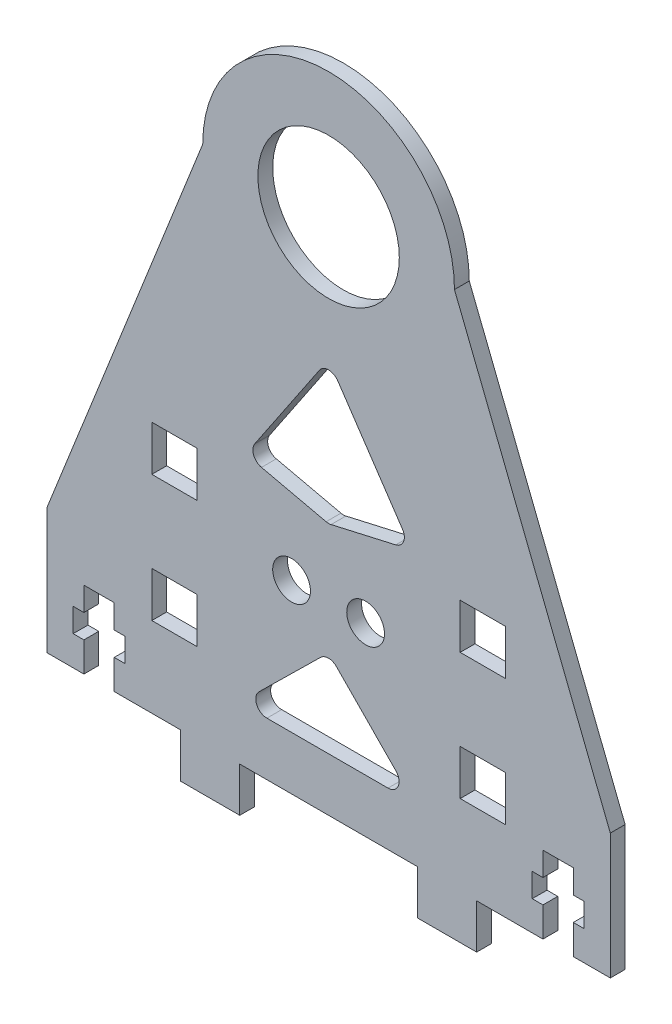
from build123d import *

# Parameters (mm, degrees)
SKETCH_1_R      = 9.55
SKETCH_1_R_2    = 2.55
SKETCH_1_W      = 6.1
SKETCH_1_H      = 6.1
EXTRUDE_1_DEPTH = 2
FILLET_3_R      = 1.5


with BuildPart() as part:
    # 草图1 → 凸台-拉伸1 (new body)
    with BuildSketch(Plane.XY):
        with BuildLine():
            Line((-28.741188564, 3.13029316), (-28.741188564, 7.13029316))
            Line((-28.741188564, 7.13029316), (-27.291188564, 7.13029316))
            Line((-27.291188564, 7.13029316), (-27.291188564, 10.33029316))
            Line((-27.291188564, 10.33029316), (-28.741188564, 10.33029316))
            Line((-28.741188564, 10.33029316), (-28.741188564, 13.53029316))
            Line((-28.741188564, 13.53029316), (-32.841188564, 13.53029316))
            Line((-32.841188564, 13.53029316), (-32.841188564, 10.33029316))
            Line((-32.841188564, 10.33029316), (-34.291188564, 10.33029316))
            Line((-34.291188564, 10.33029316), (-34.291188564, 7.13029316))
            Line((-34.291188564, 7.13029316), (-32.841188564, 7.13029316))
            Line((-32.841188564, 7.13029316), (-32.841188564, 3.13029316))
            Line((-32.841188564, 3.13029316), (-37.841188564, 3.13029316))
            Line((-37.841188564, 3.13029316), (-37.841188564, 20.08029316))
            Line((-37.841188564, 20.08029316), (-16.791188564, 73.13029316))
            ThreePointArc((-16.791188564, 73.13029316), (0.208811436, 90.13029316), (17.208811436, 73.13029316))
            Line((17.208811436, 73.13029316), (38.258811436, 20.08029316))
            Line((38.258811436, 20.08029316), (38.258811436, 3.13029316))
            Line((38.258811436, 3.13029316), (33.258811436, 3.13029316))
            Line((33.258811436, 3.13029316), (33.258811436, 7.13029316))
            Line((33.258811436, 7.13029316), (34.708811436, 7.13029316))
            Line((34.708811436, 7.13029316), (34.708811436, 10.33029316))
            Line((34.708811436, 10.33029316), (33.258811436, 10.33029316))
            Line((33.258811436, 10.33029316), (33.258811436, 13.53029316))
            Line((33.258811436, 13.53029316), (29.158811436, 13.53029316))
            Line((29.158811436, 13.53029316), (29.158811436, 10.33029316))
            Line((29.158811436, 10.33029316), (27.708811436, 10.33029316))
            Line((27.708811436, 10.33029316), (27.708811436, 7.13029316))
            Line((27.708811436, 7.13029316), (29.158811436, 7.13029316))
            Line((29.158811436, 7.13029316), (29.158811436, 3.13029316))
            Line((29.158811436, 3.13029316), (20.208811436, 3.13029316))
            Line((20.208811436, 3.13029316), (20.208811436, -2.86970684))
            Line((20.208811436, -2.86970684), (12.208811436, -2.86970684))
            Line((12.208811436, -2.86970684), (12.208811436, 3.13029316))
            Line((12.208811436, 3.13029316), (-11.791188564, 3.13029316))
            Line((-11.791188564, 3.13029316), (-11.791188564, -2.86970684))
            Line((-11.791188564, -2.86970684), (-19.791188564, -2.86970684))
            Line((-19.791188564, -2.86970684), (-19.791188564, 3.13029316))
            Line((-19.791188564, 3.13029316), (-28.741188564, 3.13029316))
        make_face()
        with Locations((0.208811436, 73.13029316)):
            Circle(SKETCH_1_R, mode=Mode.SUBTRACT)
        with Locations((-4.791188564, 28.13029316)):
            Circle(SKETCH_1_R_2, mode=Mode.SUBTRACT)
        with Locations(Location((5.208811436, 28.13029316, 0), (0, 0, 180))):
            Circle(SKETCH_1_R_2, mode=Mode.SUBTRACT)
        with Locations((-20.612527992, 34.13029316)):
            Rectangle(SKETCH_1_W, SKETCH_1_H, mode=Mode.SUBTRACT)
        with Locations((-20.612527992, 17.03029316)):
            Rectangle(SKETCH_1_W, SKETCH_1_H, mode=Mode.SUBTRACT)
        Polygon((0.208811436, 22.13029316), (-11.791188564, 10.33029316), (11.812144769, 10.33029316), align=None, mode=Mode.SUBTRACT)
        with Locations((21.030150863, 34.13029316)):
            Rectangle(SKETCH_1_W, SKETCH_1_H, mode=Mode.SUBTRACT)
        with Locations((21.030150863, 17.03029316)):
            Rectangle(SKETCH_1_W, SKETCH_1_H, mode=Mode.SUBTRACT)
        Polygon((0.208811436, 56.417251186), (-10.987657951, 39.784470466), (0.208811436, 37.232850696), (11.405280822, 39.784470466), align=None, mode=Mode.SUBTRACT)
    extrude(amount=EXTRUDE_1_DEPTH)

    # 圆角3
    fillet_3_edges = [part.edges().sort_by_distance(p)[0] for p in [
        (11.405280822, 39.784470466, 1),
        (0.208811436, 56.417251186, 1),
        (-10.987657951, 39.784470466, 1),
        (0.208811436, 37.232850696, 1),
        (11.812144769, 10.33029316, 1),
        (0.208811436, 22.13029316, 1),
        (-11.791188564, 10.33029316, 1),
    ]]
    fillet(fillet_3_edges, radius=FILLET_3_R)


solid = part.part
